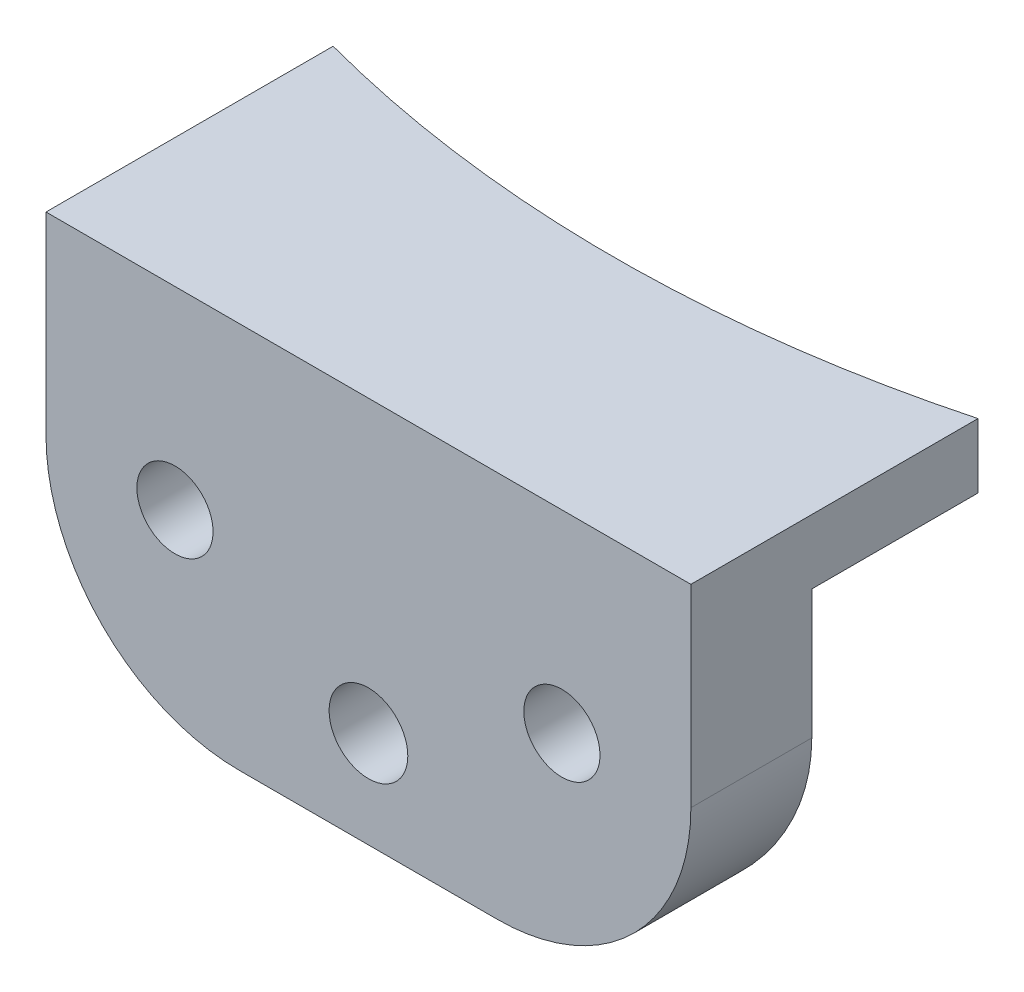
from build123d import *

# Parameters (mm, degrees)
BOSS_EXTRUDE1_DEPTH = 12.7
SKETCH2_R           = 1.500000048
CUT_EXTRUDE1_DEPTH  = 58.854101994
FILLET1_R           = 7.62
CUT_EXTRUDE2_DEPTH  = 62.533611452
BOSS_EXTRUDE2_DEPTH = 2.54


with BuildPart() as part:
    # Sketch1 → Boss-Extrude1 (new body)
    with BuildSketch(Plane(origin=(0, 0, 0), x_dir=(1, 0, 0), z_dir=(0, 1, 0))):
        with BuildLine():
            ThreePointArc((12.7, -54.091601994), (0, -55.5625), (-12.7, -54.091601994))
            Line((-12.7, -54.091601994), (-12.7, -58.854101994))
            Line((-12.7, -58.854101994), (12.7, -58.854101994))
            Line((12.7, -58.854101994), (12.7, -54.091601994))
        make_face()
    extrude(amount=BOSS_EXTRUDE1_DEPTH)

    # Sketch2 → Cut-Extrude1 (cut)
    with BuildSketch(Plane.XY):
        with Locations(Location((-7.62, 7.62, 0), (0, 0, 180))):
            Circle(SKETCH2_R)
    cut_extrude1 = extrude(amount=CUT_EXTRUDE1_DEPTH, mode=Mode.SUBTRACT)

    # Mirror1: Cut-Extrude1 across plane
    add(cut_extrude1.mirror(Plane(origin=(0, 0, 0), x_dir=(0, 0, 1), z_dir=(1, 0, 0))), mode=Mode.SUBTRACT)

    # Fillet1
    fillet1_edges = [part.edges().sort_by_distance(p)[0] for p in [
        (-12.7, 0, 56.472851994),
        (12.7, 0, 56.472851994),
    ]]
    fillet(fillet1_edges, radius=FILLET1_R)

    # Sketch2<4> → Cut-Extrude2 (cut, through all)
    with BuildSketch(Plane.XY):
        with BuildLine():
            ThreePointArc((1.549999948, 3.81), (1.096015474, 4.906015474), (0, 5.359999948))
            Line((0, 5.359999948), (0, 2.260000052))
            ThreePointArc((0, 2.260000052), (1.096015474, 2.713984526), (1.549999948, 3.81))
        make_face()
        with BuildLine():
            Line((0, 2.260000052), (0, 5.359999948))
            ThreePointArc((0, 5.359999948), (-1.549999948, 3.81), (0, 2.260000052))
        make_face()
    extrude(amount=CUT_EXTRUDE2_DEPTH, mode=Mode.SUBTRACT)

    # Sketch7 → Boss-Extrude2 (add)
    with BuildSketch(Plane(origin=(0, 12.7, 0), x_dir=(1, 0, 0), z_dir=(0, 1, 0))):
        with BuildLine():
            Line((-12.7, -54.091601994), (-12.7, -58.854101994))
            Line((-12.7, -58.854101994), (12.7, -58.854101994))
            Line((12.7, -58.854101994), (12.7, -54.091601994))
            ThreePointArc((12.7, -54.091601994), (0, -55.5625), (-12.7, -54.091601994))
        make_face()
        with BuildLine():
            ThreePointArc((-12.7, -47.545558744), (0, -49.2125), (12.7, -47.545558744))
            Line((12.7, -47.545558744), (12.7, -54.091601994))
            ThreePointArc((12.7, -54.091601994), (0, -55.5625), (-12.7, -54.091601994))
            Line((-12.7, -54.091601994), (-12.7, -47.545558744))
        make_face()
    extrude(amount=BOSS_EXTRUDE2_DEPTH)


solid = part.part
